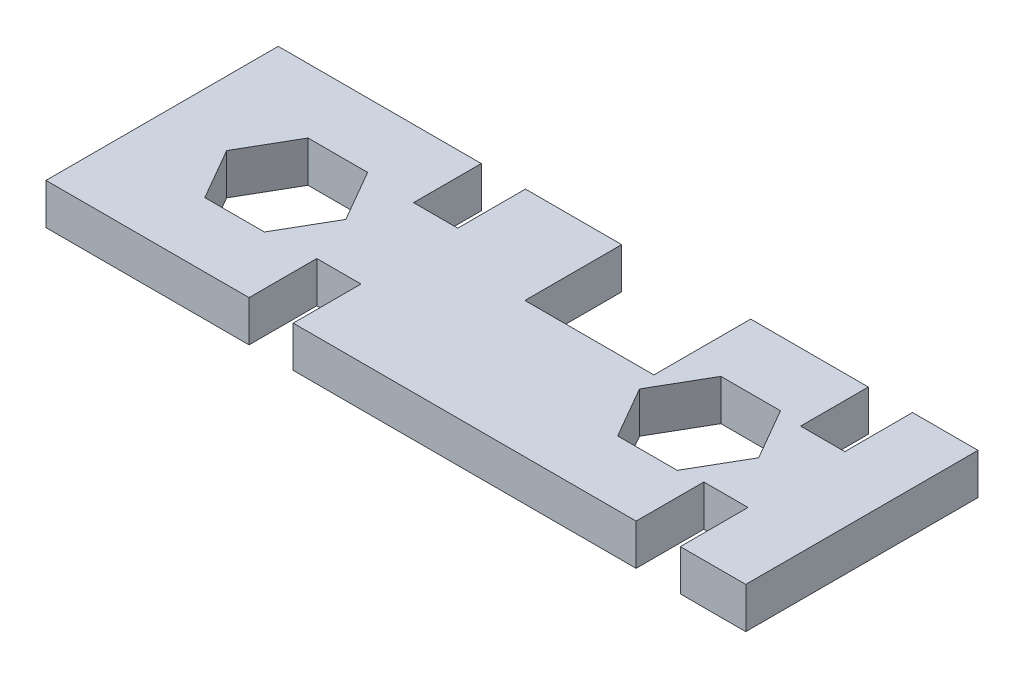
from build123d import *

# Parameters (mm, degrees)
SKETCH1_W           = 108.475208614
SKETCH1_H           = 90.5
BOSS_EXTRUDE1_DEPTH = 3.175
SKETCH2_W           = 6.85
SKETCH2_H           = 10.5
CUT_EXTRUDE1_DEPTH  = 93.588961798
LPATTERN1_COUNT     = 2
LPATTERN1_PITCH     = 60
SKETCH3_W           = 19.995208614
SKETCH3_H           = 15
CUT_EXTRUDE2_DEPTH  = 93.588961798
SKETCH4_W           = 6.85
SKETCH4_H           = 10.5
CUT_EXTRUDE3_DEPTH  = 93.588961798
SHORT_DEPTH         = 93.588961798


with BuildPart() as part:
    # Sketch1 → Boss-Extrude1 (new, symmetric)
    with BuildSketch(Plane(origin=(0, 0, 0), x_dir=(1, 0, 0), z_dir=(0, 1, 0))):
        with Locations((3, -27.25)):
            Rectangle(SKETCH1_W, SKETCH1_H)
        Polygon((-22.762395693, 0), (-27.381197846, 8), (-36.618802154, 8), (-41.237604307, 0), (-36.618802154, -8), (-27.381197846, -8), align=None, mode=Mode.SUBTRACT)
        Polygon((41.237604307, 0), (36.618802154, 8), (27.381197846, 8), (22.762395693, 0), (27.381197846, -8), (36.618802154, -8), align=None, mode=Mode.SUBTRACT)
    extrude(amount=BOSS_EXTRUDE1_DEPTH, both=True)

    # Sketch2 → Cut-Extrude1 (cut, through all)
    with BuildSketch(Plane(origin=(0, 3.175, 0), x_dir=(1, 0, 0), z_dir=(0, 1, 0))):
        with Locations((-16.337395693, 12.75)):
            Rectangle(SKETCH2_W, SKETCH2_H)
        with Locations((-16.337395693, -67.25)):
            Rectangle(SKETCH2_W, SKETCH2_H)
        with Locations((-16.337395693, -27.25)):
            Rectangle(SKETCH2_W, SKETCH2_H)
    cut_extrude1 = extrude(amount=-CUT_EXTRUDE1_DEPTH, mode=Mode.SUBTRACT)

    # LPattern1: Cut-Extrude1 ×2
    with Locations(*[(i * LPATTERN1_PITCH, 0, 0) for i in range(1, LPATTERN1_COUNT)]):
        add(cut_extrude1, mode=Mode.SUBTRACT)

    # Sketch3 → Cut-Extrude2 (cut, through all)
    with BuildSketch(Plane(origin=(0, 3.175, 0), x_dir=(1, 0, 0), z_dir=(0, 1, 0))):
        with Locations((12, 10.5)):
            Rectangle(SKETCH3_W, SKETCH3_H)
    extrude(amount=-CUT_EXTRUDE2_DEPTH, mode=Mode.SUBTRACT)

    # Sketch4 → Cut-Extrude3 (cut, through all)
    with BuildSketch(Plane(origin=(0, 3.175, 0), x_dir=(1, 0, 0), z_dir=(0, 1, 0))):
        with Locations((50.512604307, -64.25)):
            Rectangle(SKETCH4_W, SKETCH4_H)
        with Locations((50.512604307, -31.95)):
            Rectangle(SKETCH4_W, SKETCH4_H)
    extrude(amount=-CUT_EXTRUDE3_DEPTH, mode=Mode.SUBTRACT)

    # Sketch5 → Short (cut, through all)
    with BuildSketch(Plane(origin=(0, 3.175, 0), x_dir=(1, 0, 0), z_dir=(0, 1, 0))):
        Polygon((-51.237604307, -72.5), (57.237604307, -72.5), (57.237604307, -18), (47.087604307, -18), (47.087604307, -7.5), (40.237604307, -7.5), (40.237604307, -18), (-12.912395693, -18), (-12.912395693, -7.5), (-19.762395693, -7.5), (-19.762395693, -18), (-51.237604307, -18), align=None)
    extrude(amount=-SHORT_DEPTH, mode=Mode.SUBTRACT)


solid = part.part
